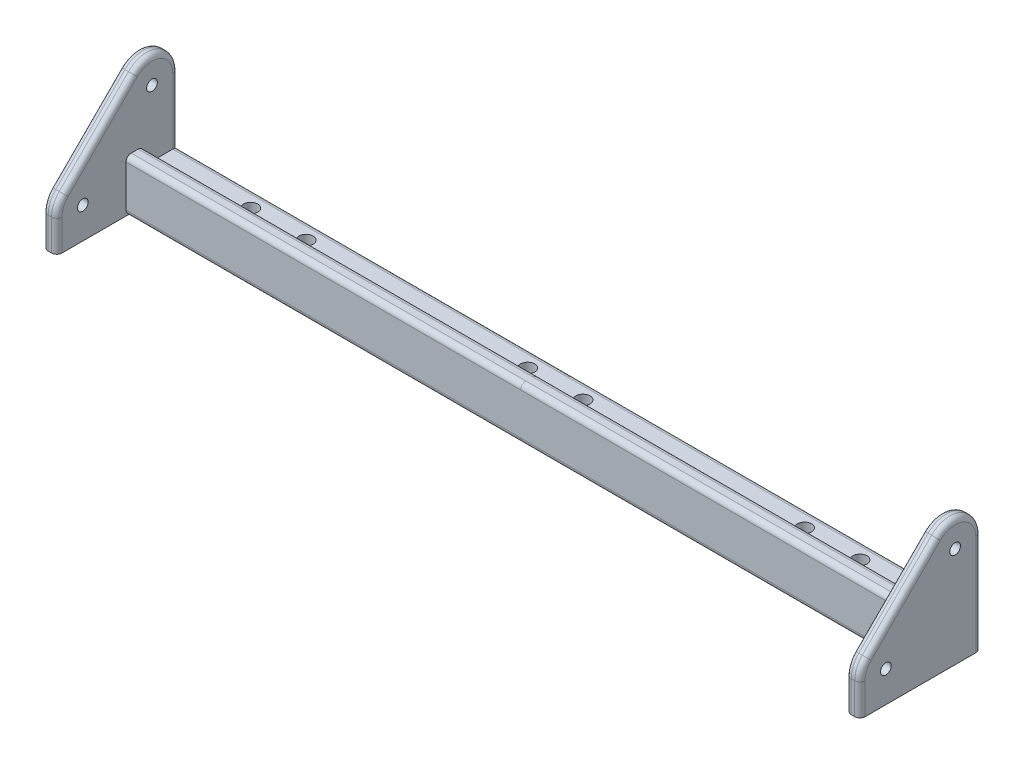
from build123d import *

# Parameters (mm, degrees)
BOSS_EXTRU_1_DEPTH      = 15
ESQUISSE2_R             = 1.55
ESQUISSE2_W             = 15
ESQUISSE2_H             = 10
BOSS_EXTRU_2_DEPTH      = 4
ESQUISSE5_R             = 2.05
ENL_V_MAT_EXTRU_3_DEPTH = 129.379320765
ESQUISSE7_W             = 114
ESQUISSE7_H             = 5
BOSS_EXTRU_3_DEPTH      = 5
CONG_1_R                = 1.5
CONG_1_OF_SYM_TRIE5_R   = 1.5


with BuildPart() as part:
    # Esquisse1 → Boss.-Extru.1 (new body)
    with BuildSketch(Plane.XY):
        Polygon((0, 10), (0, 5), (0, 0), (114, 0), (114, 10), align=None)
    boss_extru_1 = extrude(amount=BOSS_EXTRU_1_DEPTH)

    # Esquisse2 → Boss.-Extru.2 (add)
    # profile 1 of 2: a face of its own
    with BuildSketch(Plane(origin=(114, 0, 0), x_dir=(0, 0, -1), z_dir=(1, 0, 0))):
        with BuildLine():
            ThreePointArc((0, 29), (-4.629874257, 35.929096494), (-12.803300859, 34.303300859))
            Line((-12.803300859, 34.303300859), (-32.803300859, 14.303300859))
            ThreePointArc((-32.803300859, 14.303300859), (-34.429096494, 11.870125743), (-35, 9))
            Line((-35, 9), (-35, 0))
            Line((-35, 0), (-15, 0))
            Line((-15, 0), (-15, 10))
            Line((-15, 10), (0, 10))
            Line((0, 10), (0, 29))
        make_face()
        with Locations((-27.5, 9)):
            Circle(ESQUISSE2_R, mode=Mode.SUBTRACT)
        with Locations((-7.5, 29)):
            Circle(ESQUISSE2_R, mode=Mode.SUBTRACT)
    # profile 2 of 2: a face of its own
    with BuildSketch(Plane(origin=(114, 0, 0), x_dir=(0, 0, -1), z_dir=(1, 0, 0))):
        with Locations((-7.5, 5)):
            Rectangle(ESQUISSE2_W, ESQUISSE2_H)
    boss_extru_2 = extrude(amount=BOSS_EXTRU_2_DEPTH)

    # Esquisse5 → Enlèv. mat.-Extru.3 (cut, through all)
    with BuildSketch(Plane.XZ):
        with Locations(Location((8, 5, 0), (0, 0, 270))):
            Circle(ESQUISSE5_R)
        with Locations(Location((72, 5, 0), (0, 0, 270))):
            Circle(ESQUISSE5_R)
        with Locations((88, 5)):
            Circle(ESQUISSE5_R)
    enl_v_mat_extru_3 = extrude(amount=-ENL_V_MAT_EXTRU_3_DEPTH, mode=Mode.SUBTRACT)

    # Esquisse7 → Boss.-Extru.3 (add)
    with BuildSketch(Plane(origin=(0, 10, 0), x_dir=(1, 0, 0), z_dir=(0, 1, 0))):
        with Locations((57, -12.5)):
            Rectangle(ESQUISSE7_W, ESQUISSE7_H)
    boss_extru_3 = extrude(amount=BOSS_EXTRU_3_DEPTH)

    # Congé1
    cong_1_edges = [part.edges().sort_by_distance(p)[0] for p in [
        (114, 35.929096494, 4.629874257),
        (114, 24.303300859, 22.803300859),
        (114, 11.870125743, 34.429096494),
        (114, 4.5, 35),
        (118, 14.5, 0),
        (114, 19.5, 0),
        (118, 35.929096494, 4.629874257),
        (118, 24.303300859, 22.803300859),
        (118, 11.870125743, 34.429096494),
        (118, 4.5, 35),
        (57, 0, 15),
        (57, 15, 10),
        (57, 15, 15),
        (57, 10, 10),
        (57, 10, 0),
    ]]
    fillet(cong_1_edges, radius=CONG_1_R)

    # Symétrie5: Boss.-Extru.1, Boss.-Extru.2, Enlèv. mat.-Extru.3, Boss.-Extru.3 across plane
    add(boss_extru_1.mirror(Plane(origin=(0, 5, 15), x_dir=(0, 0, 1), z_dir=(1, 0, 0))))
    add(boss_extru_2.mirror(Plane(origin=(0, 5, 15), x_dir=(0, 0, 1), z_dir=(1, 0, 0))))
    add(enl_v_mat_extru_3.mirror(Plane(origin=(0, 5, 15), x_dir=(0, 0, 1), z_dir=(1, 0, 0))), mode=Mode.SUBTRACT)
    add(boss_extru_3.mirror(Plane(origin=(0, 5, 15), x_dir=(0, 0, 1), z_dir=(1, 0, 0))))

    # Congé1 of Symétrie5
    cong_1_of_sym_trie5_edges = [part.edges().sort_by_distance(p)[0] for p in [
        (-114, 35.929096494, 4.629874257),
        (-114, 24.303300859, 22.803300859),
        (-114, 11.870125743, 34.429096494),
        (-114, 4.5, 35),
        (-118, 14.5, 0),
        (-114, 19.5, 0),
        (-118, 35.929096494, 4.629874257),
        (-118, 24.303300859, 22.803300859),
        (-118, 11.870125743, 34.429096494),
        (-118, 4.5, 35),
        (-57, 0, 15),
        (-57, 15, 10),
        (-57, 15, 15),
        (-57, 10, 10),
        (-57, 10, 0),
    ]]
    fillet(cong_1_of_sym_trie5_edges, radius=CONG_1_OF_SYM_TRIE5_R)


solid = part.part
